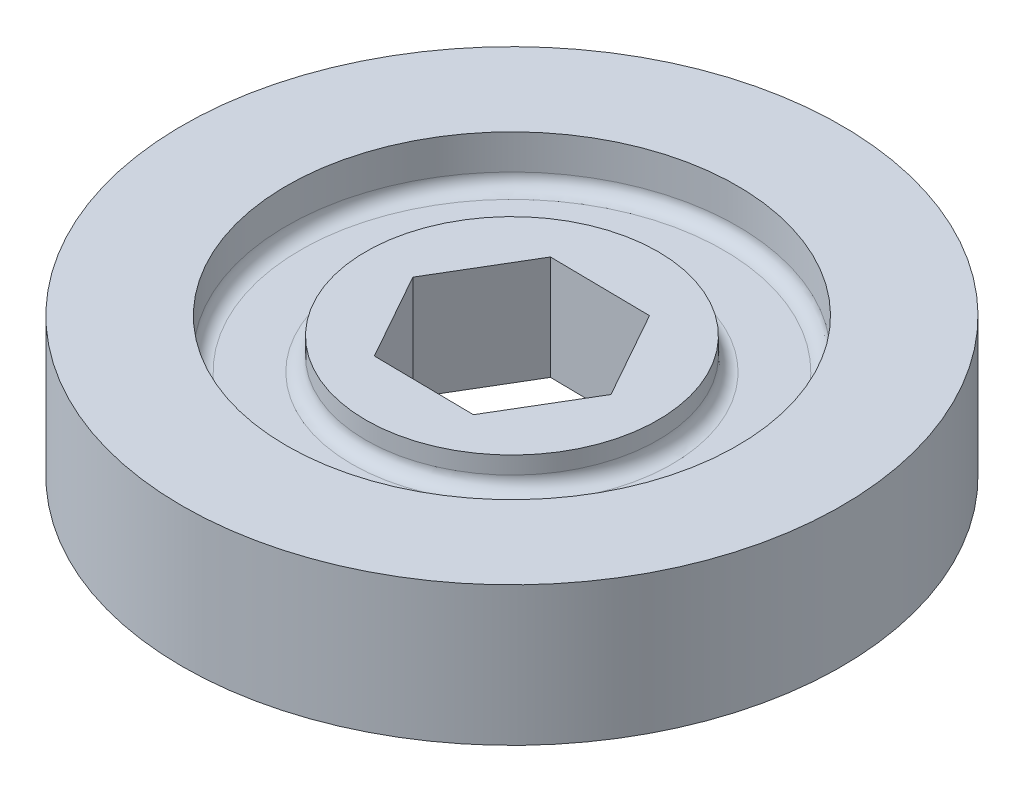
from build123d import *

# Parameters (mm, degrees)
SKETCH1_R               = 23.7
BOSS_EXTRUDE1_DEPTH     = 10
SKETCH2_R               = 16.2
CUT_EXTRUDE1_DEPTH      = 3.5
CUT_EXTRUDE2_START      = -3.5
SKETCH3_R               = 16.2
CUT_EXTRUDE2_DEPTH      = 3.5
SKETCH5_R               = 10.5
BOSS_EXTRUDE2_DEPTH     = 2.25
BOSS_EXTRUDE3_START     = 2.25
SKETCH6_R               = 10.5
BOSS_EXTRUDE3_DEPTH     = 2.25
CUT_EXTRUDE3_DEPTH      = 35.141323934
CUT_EXTRUDE3_DEPTH_BACK = 35.141323934
FILLET1_R               = 1
FILLET2_R               = 1


with BuildPart() as part:
    # Sketch1 → Boss-Extrude1 (new body)
    with BuildSketch(Plane(origin=(0, 0, 0), x_dir=(1, 0, 0), z_dir=(0, 1, 0))):
        with Locations(Location((0, 0, 0), (0, 0, 270))):
            Circle(SKETCH1_R)
    extrude(amount=BOSS_EXTRUDE1_DEPTH)

    # Sketch2 → Cut-Extrude1 (cut)
    with BuildSketch(Plane(origin=(0, 10, 0), x_dir=(1, 0, 0), z_dir=(0, 1, 0))):
        with Locations(Location((0, 0, 0), (0, 0, 270))):
            Circle(SKETCH2_R)
    extrude(amount=-CUT_EXTRUDE1_DEPTH, mode=Mode.SUBTRACT)

    # Sketch3 → Cut-Extrude2 (cut)
    with BuildSketch(Plane.XZ.offset(CUT_EXTRUDE2_START)):
        with Locations(Location((0, 0, 0), (0, 0, 90))):
            Circle(SKETCH3_R)
    extrude(amount=CUT_EXTRUDE2_DEPTH, mode=Mode.SUBTRACT)

    # Sketch5 → Boss-Extrude2 (add)
    with BuildSketch(Plane(origin=(0, 6.5, 0), x_dir=(1, 0, 0), z_dir=(0, 1, 0))):
        with Locations(Location((0, 0, 0), (0, 0, 270))):
            Circle(SKETCH5_R)
    extrude(amount=BOSS_EXTRUDE2_DEPTH)

    # Sketch6 → Boss-Extrude3 (add)
    with BuildSketch(Plane.XZ.offset(-3.5).offset(BOSS_EXTRUDE3_START)):
        with Locations(Location((0, 0, 0), (0, 0, 90))):
            Circle(SKETCH6_R)
    extrude(amount=-BOSS_EXTRUDE3_DEPTH)

    # Sketch4 → Cut-Extrude3 (cut, two sides: drawn at the far end of the back side and taken through both)
    with BuildSketch(Plane(origin=(0, 6.5, 0), x_dir=(1, 0, 0), z_dir=(0, 1, 0)).offset(-CUT_EXTRUDE3_DEPTH_BACK)):
        Polygon((3.689639098, 6.202410552), (-3.526625554, 6.296526466), (-7.216264652, 0.094115913), (-3.689639098, -6.202410552), (3.526625554, -6.296526466), (7.216264652, -0.094115913), align=None)
    extrude(amount=CUT_EXTRUDE3_DEPTH + CUT_EXTRUDE3_DEPTH_BACK, mode=Mode.SUBTRACT)

    # Fillet1
    fillet1_edges = [part.edges().sort_by_distance(p)[0] for p in [
        (0, 3.5, -16.2),
        (0, 6.5, -16.2),
    ]]
    fillet(fillet1_edges, radius=FILLET1_R)

    # Fillet2
    fillet2_edges = [part.edges().sort_by_distance(p)[0] for p in [
        (0, 6.5, -10.5),
        (0, 3.5, -10.5),
    ]]
    fillet(fillet2_edges, radius=FILLET2_R)


solid = part.part
